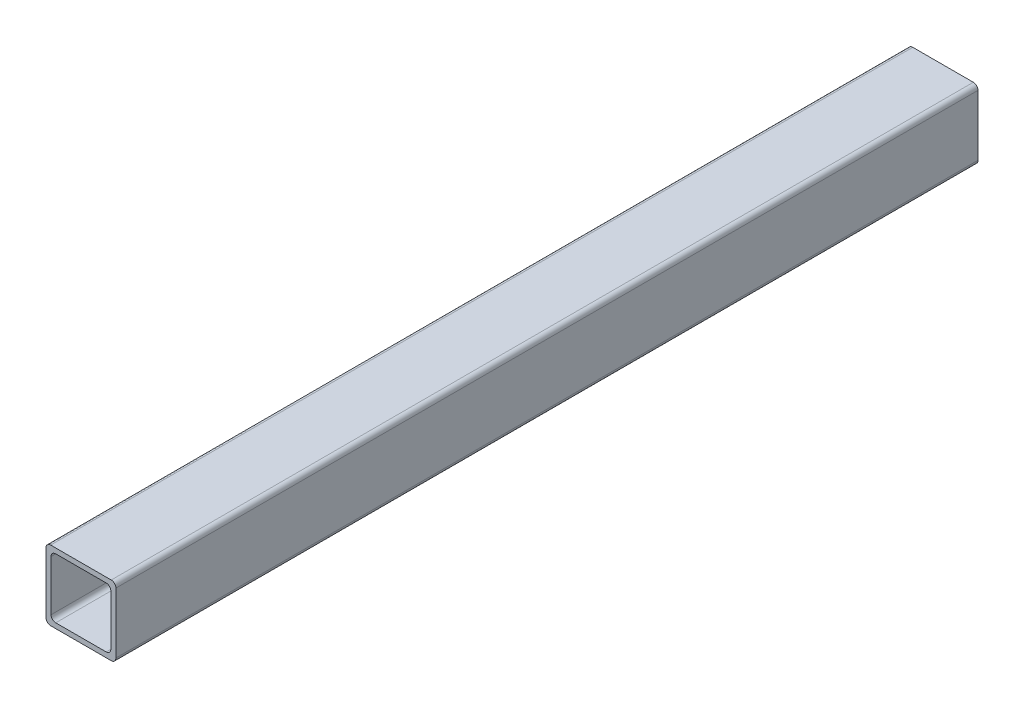
from build123d import *

# Parameters (mm, degrees)
BOSS_EXTRUDE1_DEPTH = 470


with BuildPart() as part:
    # Sketch1 → Boss-Extrude1 (new body)
    with BuildSketch(Plane.XY):
        with BuildLine():
            Line((2.54, 0), (35.56, 0))
            ThreePointArc((35.56, 0), (37.356051224, -0.743948776), (38.1, -2.54))
            Line((38.1, -2.54), (38.1, -35.56))
            ThreePointArc((38.1, -35.56), (37.356051224, -37.356051224), (35.56, -38.1))
            Line((35.56, -38.1), (2.54, -38.1))
            ThreePointArc((2.54, -38.1), (0.743948776, -37.356051224), (0, -35.56))
            Line((0, -35.56), (0, -2.54))
            ThreePointArc((0, -2.54), (0.743948776, -0.743948776), (2.54, 0))
        make_face()
        with BuildLine():
            Line((5.3086, -2.7686), (32.7914, -2.7686))
            ThreePointArc((32.7914, -2.7686), (34.587451224, -3.512548776), (35.3314, -5.3086))
            Line((35.3314, -5.3086), (35.3314, -32.7914))
            ThreePointArc((35.3314, -32.7914), (34.587451224, -34.587451224), (32.7914, -35.3314))
            Line((32.7914, -35.3314), (5.3086, -35.3314))
            ThreePointArc((5.3086, -35.3314), (3.512548776, -34.587451224), (2.7686, -32.7914))
            Line((2.7686, -32.7914), (2.7686, -5.3086))
            ThreePointArc((2.7686, -5.3086), (3.512548776, -3.512548776), (5.3086, -2.7686))
        make_face(mode=Mode.SUBTRACT)
    extrude(amount=BOSS_EXTRUDE1_DEPTH)


solid = part.part
